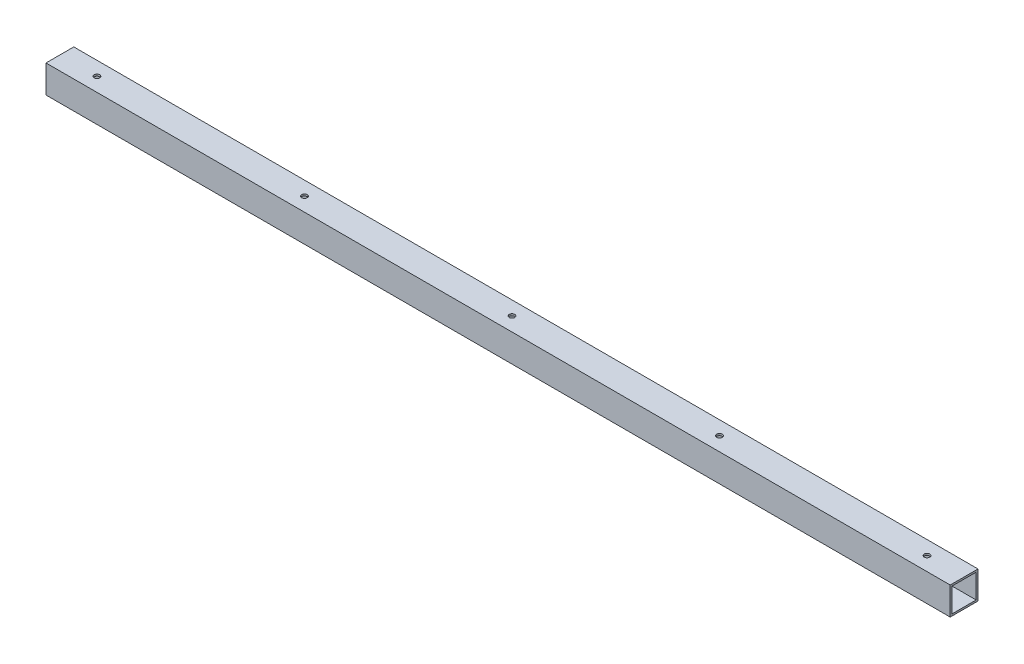
from build123d import *

# Parameters (mm, degrees)
SKETCH_21_W         = 15
SKETCH_21_H         = 15
SKETCH_21_W_2       = 13
SKETCH_21_H_2       = 13
F_15X15X1_1_DEPTH   = 488
SKETCH_3_R          = 1.5
CUT_EXTRUDE_1_DEPTH = 245.575652917


with BuildPart() as part:
    # 草图21 → 矩形管 方铝管15X15X1(1) (new body)
    with BuildSketch(Plane(origin=(-244, 0, 0), x_dir=(0, 0, -1), z_dir=(1, 0, 0))):
        Rectangle(SKETCH_21_W, SKETCH_21_H)
        Rectangle(SKETCH_21_W_2, SKETCH_21_H_2, mode=Mode.SUBTRACT)
    extrude(amount=F_15X15X1_1_DEPTH)

    # 草图3 → 切除-拉伸1 (cut, through all)
    with BuildSketch(Plane(origin=(0, -7.5, 0), x_dir=(1, 0, 0), z_dir=(0, 1, 0))):
        with Locations(Location((-224, 0, 0), (0, 0, 270))):
            Circle(SKETCH_3_R)
        with Locations(Location((-112, 0, 0), (0, 0, 270))):
            Circle(SKETCH_3_R)
        with Locations(Location((0, 0, 0), (0, 0, 270))):
            Circle(SKETCH_3_R)
        with Locations(Location((112, 0, 0), (0, 0, 270))):
            Circle(SKETCH_3_R)
        with Locations(Location((224, 0, 0), (0, 0, 270))):
            Circle(SKETCH_3_R)
    extrude(amount=CUT_EXTRUDE_1_DEPTH, mode=Mode.SUBTRACT)


solid = part.part
